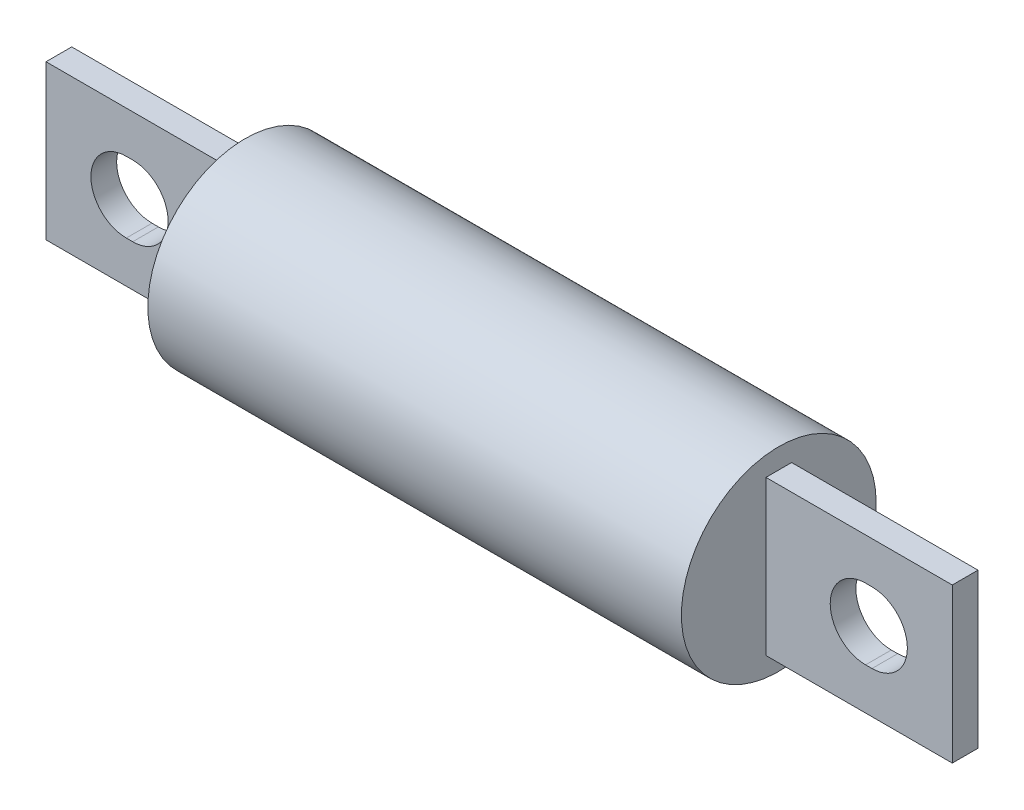
from build123d import *

# Parameters (mm, degrees)
SKETCH1_R                = 12.0269
BOSS_EXTRUDE1_DEPTH      = 65.8876
BOSS_EXTRUDE2_DEPTH      = 23.0124
BOSS_EXTRUDE2_DEPTH_BACK = 88.9
SKETCH2_W                = 3.175
SKETCH2_H                = 19.05
CUT_EXTRUDE1_DEPTH       = 23.0124
CUT_EXTRUDE2_DEPTH       = 23.0124


with BuildPart() as part:
    # Sketch1 → Boss-Extrude1 (new body)
    with BuildSketch(Plane(origin=(0, 0, 0), x_dir=(0, 0, -1), z_dir=(1, 0, 0))):
        Circle(SKETCH1_R)
    extrude(amount=BOSS_EXTRUDE1_DEPTH)

    # Sketch2 → Boss-Extrude2 (add, two sides: drawn at the far end of the back side and taken through both)
    with BuildSketch(Plane(origin=(65.8876, 0, 0), x_dir=(0, 0, -1), z_dir=(1, 0, 0)).offset(-BOSS_EXTRUDE2_DEPTH_BACK)):
        Rectangle(SKETCH2_W, SKETCH2_H)
    extrude(amount=BOSS_EXTRUDE2_DEPTH + BOSS_EXTRUDE2_DEPTH_BACK)

    # Sketch5 → Cut-Extrude1 (cut)
    with BuildSketch(Plane(origin=(0, 0, -1.5875), x_dir=(-1, 0, 0), z_dir=(0, 0, -1))):
        with BuildLine():
            Line((-78.9813, 4.3688), (-78.1939, 4.3688))
            ThreePointArc((-78.1939, 4.3688), (-73.8251, 0), (-78.1939, -4.3688))
            Line((-78.1939, -4.3688), (-78.9813, -4.3688))
            ThreePointArc((-78.9813, -4.3688), (-83.3501, 0), (-78.9813, 4.3688))
        make_face()
    extrude(amount=-CUT_EXTRUDE1_DEPTH, mode=Mode.SUBTRACT)

    # Sketch6 → Cut-Extrude2 (cut)
    with BuildSketch(Plane(origin=(0, 0, -1.5875), x_dir=(-1, 0, 0), z_dir=(0, 0, -1))):
        with BuildLine():
            Line((13.095, -4.37), (12.305, -4.37))
            ThreePointArc((12.305, -4.37), (7.935, 0), (12.305, 4.37))
            Line((12.305, 4.37), (13.095, 4.37))
            ThreePointArc((13.095, 4.37), (17.465, 0), (13.095, -4.37))
        make_face()
    extrude(amount=-CUT_EXTRUDE2_DEPTH, mode=Mode.SUBTRACT)


solid = part.part
